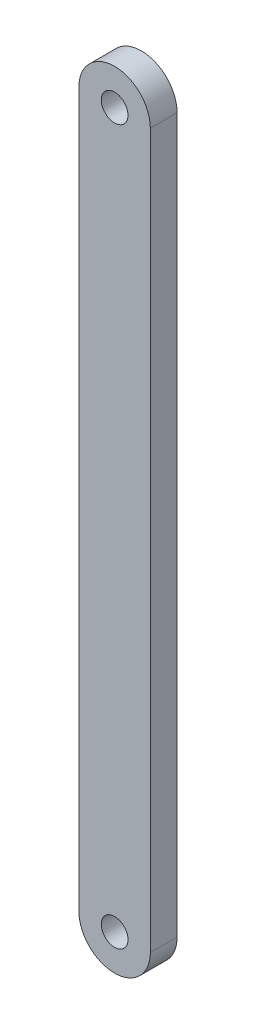
from build123d import *

# Parameters (mm, degrees)
SKETCH_1_R      = 1.5
EXTRUDE_1_DEPTH = 3


with BuildPart() as part:
    # 草圖1 → 填料-伸長1 (new body)
    with BuildSketch(Plane.XY):
        with BuildLine():
            Line((40.300099998, 5.000000006), (40.300099999, 85.0001))
            ThreePointArc((40.300099999, 85.0001), (44.300149999, 88.999999999), (48.300099999, 84.999999999))
            Line((48.300099999, 84.999999999), (48.300099999, 5.000000003))
            add(Edge.make_bspline(
                [(40.300099998, 5.000000006), (40.300099994, 2.656854252), (41.956954243, 0.999999999), (44.300099997, 0.999999998), (46.64324575, 0.999999997), (48.300100001, 2.656854249), (48.300099999, 5.000000003)],
                knots=[0, 0, 0, 0, 0.5, 0.5, 0.5, 1, 1, 1, 1], degree=3, weights=[1, 0.804737854, 0.804737854, 1, 0.804737854, 0.804737854, 1]))
        make_face()
        with Locations((44.300099998, 4.999999998)):
            Circle(SKETCH_1_R, mode=Mode.SUBTRACT)
        with Locations((44.300099998, 84.999999998)):
            Circle(SKETCH_1_R, mode=Mode.SUBTRACT)
    extrude(amount=EXTRUDE_1_DEPTH)


solid = part.part
